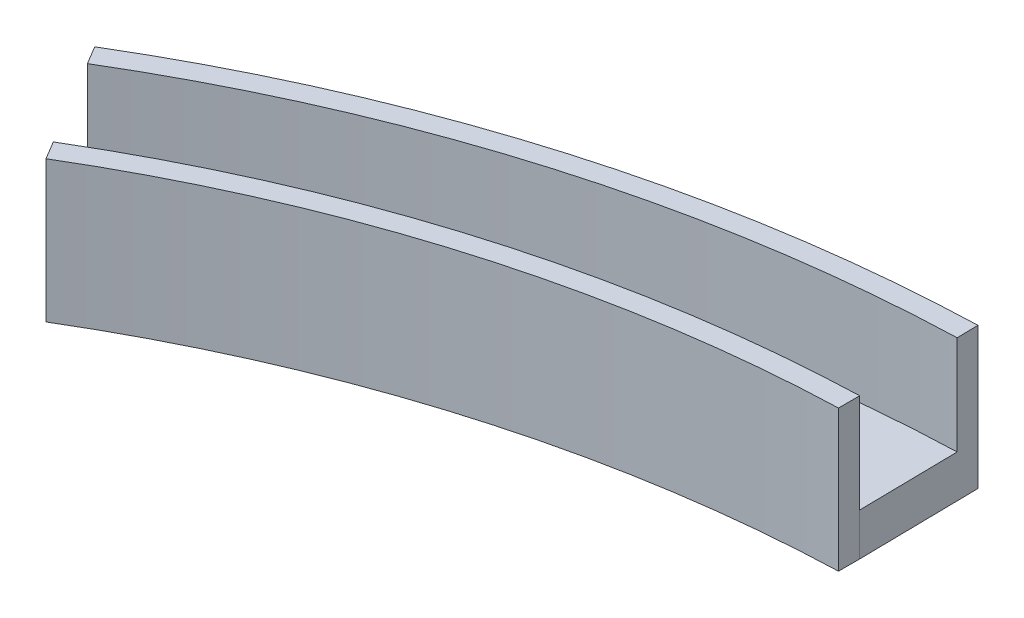
from build123d import *

# Parameters (mm, degrees)
BOSS_EXTRUDE1_DEPTH = 10
CUT_EXTRUDE1_DEPTH  = 7


with BuildPart() as part:
    # Sketch2 → Boss-Extrude1 (new body)
    with BuildSketch(Plane(origin=(0, 0, 0), x_dir=(1, 0, 0), z_dir=(0, 1, 0))):
        with BuildLine():
            Line((-51.50406107, 86.072206422), (-47.139527706, 78.778315244))
            Line((-47.139527706, 78.778315244), (-46.369315936, 77.491157977))
            ThreePointArc((-46.369315936, 77.491157977), (-25.527153744, 86.621922437), (-3.064253537, 90.252996489))
            Line((-3.064253537, 90.252996489), (-3.064253537, 91.753846651))
            Line((-3.064253537, 91.753846651), (-3.197123883, 100.254034452))
            ThreePointArc((-3.197123883, 100.254034452), (-28.254839769, 96.243218227), (-51.50406107, 86.072206422))
        make_face()
    extrude(amount=BOSS_EXTRUDE1_DEPTH)

    # Sketch4 → Cut-Extrude1 (cut)
    with BuildSketch(Plane(origin=(0, 10, 0), x_dir=(1, 0, 0), z_dir=(0, 1, 0))):
        with BuildLine():
            Line((-50.7338493, 84.785049155), (-47.139527706, 78.778315244))
            ThreePointArc((-47.139527706, 78.778315244), (-25.92674327, 88.067939731), (-3.064253537, 91.753846651))
            Line((-3.064253537, 91.753846651), (-3.173676414, 98.754016642))
            ThreePointArc((-3.173676414, 98.754016642), (-27.844000167, 94.800525735), (-50.7338493, 84.785049155))
        make_face()
    extrude(amount=-CUT_EXTRUDE1_DEPTH, mode=Mode.SUBTRACT)


solid = part.part
